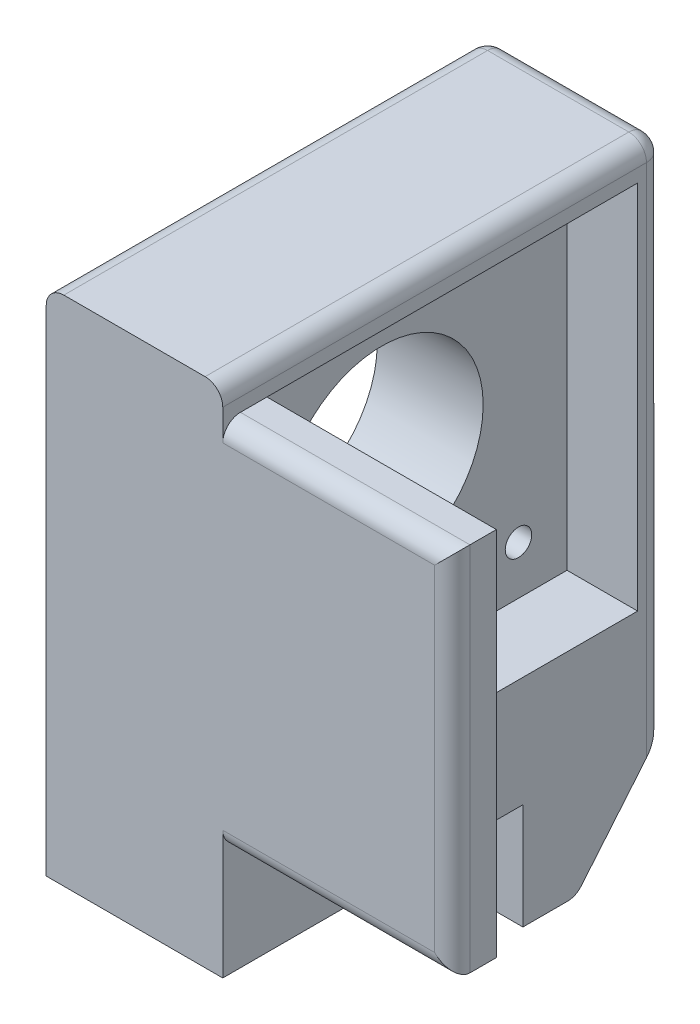
from build123d import *

# Parameters (mm, degrees)
SKETCH1_W           = 20
SKETCH1_H           = 50
BOSS_EXTRUDE1_DEPTH = 70
SKETCH2_R           = 1.5
SKETCH2_R_2         = 11.5
CUT_EXTRUDE2_DEPTH  = 60
SKETCH4_W           = 34
SKETCH4_H           = 12
CUT_EXTRUDE3_DEPTH  = 60
SKETCH8_R           = 2
CUT_EXTRUDE5_DEPTH  = 15
SKETCH9_W           = 42
SKETCH9_H           = 42
CUT_EXTRUDE6_DEPTH  = 8
CUT_EXTRUDE8_DEPTH  = 30
SKETCH17_R          = 3.5
CUT_EXTRUDE13_DEPTH = 9.18109305
SKETCH18_R          = 1.5
CUT_EXTRUDE14_DEPTH = 7
FILLET1_R           = 2
FILLET2_R           = 2
FILLET3_R           = 2
FILLET4_R           = 2
SKETCH19_W          = 5
SKETCH19_H          = 42
BOSS_EXTRUDE2_DEPTH = 26
FILLET6_R           = 2


with BuildPart() as part:
    # Sketch1 → Boss-Extrude1 (new body)
    with BuildSketch(Plane(origin=(0, 0, 0), x_dir=(1, 0, 0), z_dir=(0, 1, 0))):
        with Locations((-10, -25)):
            Rectangle(SKETCH1_W, SKETCH1_H)
    extrude(amount=BOSS_EXTRUDE1_DEPTH)

    # Sketch2 → Cut-Extrude2 (cut)
    with BuildSketch(Plane(origin=(0, 0, 0), x_dir=(0, 0, -1), z_dir=(1, 0, 0))):
        with Locations((-8.5, 61)):
            Circle(SKETCH2_R)
        with Locations((-24, 45.5)):
            Circle(SKETCH2_R_2)
        with Locations((-8.5, 30)):
            Circle(SKETCH2_R)
        with Locations((-39.5, 30)):
            Circle(SKETCH2_R)
        with Locations((-39.5, 61)):
            Circle(SKETCH2_R)
    extrude(amount=-CUT_EXTRUDE2_DEPTH, mode=Mode.SUBTRACT)

    # Sketch4 → Cut-Extrude3 (cut)
    with BuildSketch(Plane(origin=(0, 0, 0), x_dir=(0, 0, -1), z_dir=(1, 0, 0))):
        with Locations((-33, 6)):
            Rectangle(SKETCH4_W, SKETCH4_H)
    extrude(amount=-CUT_EXTRUDE3_DEPTH, mode=Mode.SUBTRACT)

    # Sketch8 → Cut-Extrude5 (cut)
    with BuildSketch(Plane(origin=(0, 0, 0), x_dir=(-1, 0, 0), z_dir=(0, 0, -1))):
        with Locations((15, 6)):
            Circle(SKETCH8_R)
        with Locations((5, 6)):
            Circle(SKETCH8_R)
    extrude(amount=-CUT_EXTRUDE5_DEPTH, mode=Mode.SUBTRACT)

    # Sketch9 → Cut-Extrude6 (cut)
    with BuildSketch(Plane(origin=(0, 0, 0), x_dir=(0, 0, -1), z_dir=(1, 0, 0))):
        with Locations((-24, 45.5)):
            Rectangle(SKETCH9_W, SKETCH9_H)
    extrude(amount=-CUT_EXTRUDE6_DEPTH, mode=Mode.SUBTRACT)

    # Sketch11 → Cut-Extrude8 (cut)
    with BuildSketch(Plane(origin=(0, 0, 0), x_dir=(0, 0, -1), z_dir=(1, 0, 0))):
        Polygon((-10, 0), (0, 0), (0, 12), align=None)
    extrude(amount=-CUT_EXTRUDE8_DEPTH, mode=Mode.SUBTRACT)

    # Sketch17 → Cut-Extrude13 (cut)
    with BuildSketch(Plane(origin=(0, 0, 0), x_dir=(-1, 0, 0), z_dir=(0, 0, -1))):
        with Locations((15, 6)):
            Circle(SKETCH17_R)
        with Locations((5, 6)):
            Circle(SKETCH17_R)
    extrude(amount=-CUT_EXTRUDE13_DEPTH, mode=Mode.SUBTRACT)

    # Sketch18 → Cut-Extrude14 (cut)
    with BuildSketch(Plane.ZY.offset(20)):
        with Locations((46, 20)):
            Circle(SKETCH18_R)
        with Locations((39, 20)):
            Circle(SKETCH18_R)
    extrude(amount=-CUT_EXTRUDE14_DEPTH, mode=Mode.SUBTRACT)

    # Fillet1
    fillet1_edges = [part.edges().sort_by_distance(p)[0] for p in [
        (-20, 41, 0),
    ]]
    fillet(fillet1_edges, radius=FILLET1_R)

    # Fillet2
    fillet2_edges = [part.edges().sort_by_distance(p)[0] for p in [
        (-20, 70, 26),
        (-19.414213562, 70, 0.585786438),
        (-9, 70, 0),
    ]]
    fillet(fillet2_edges, radius=FILLET2_R)

    # Fillet3
    fillet3_edges = [part.edges().sort_by_distance(p)[0] for p in [
        (0, 40, 0),
        (0, 69.414213562, 0.585786438),
        (0, 70, 26),
    ]]
    fillet(fillet3_edges, radius=FILLET3_R)

    # Fillet4
    fillet4_edges = [part.edges().sort_by_distance(p)[0] for p in [
        (-10, 0, 10),
    ]]
    fillet(fillet4_edges, radius=FILLET4_R)

    # Sketch19 → Boss-Extrude2 (add)
    with BuildSketch(Plane(origin=(0, 0, 0), x_dir=(0, 0, -1), z_dir=(1, 0, 0))):
        with Locations((-47.5, 45.5)):
            Rectangle(SKETCH19_W, SKETCH19_H)
    extrude(amount=BOSS_EXTRUDE2_DEPTH)

    # Fillet6
    fillet6_edges = [part.edges().sort_by_distance(p)[0] for p in [
        (13, 66.5, 50),
        (13, 24.5, 50),
        (26, 45.5, 50),
    ]]
    fillet(fillet6_edges, radius=FILLET6_R)


solid = part.part
